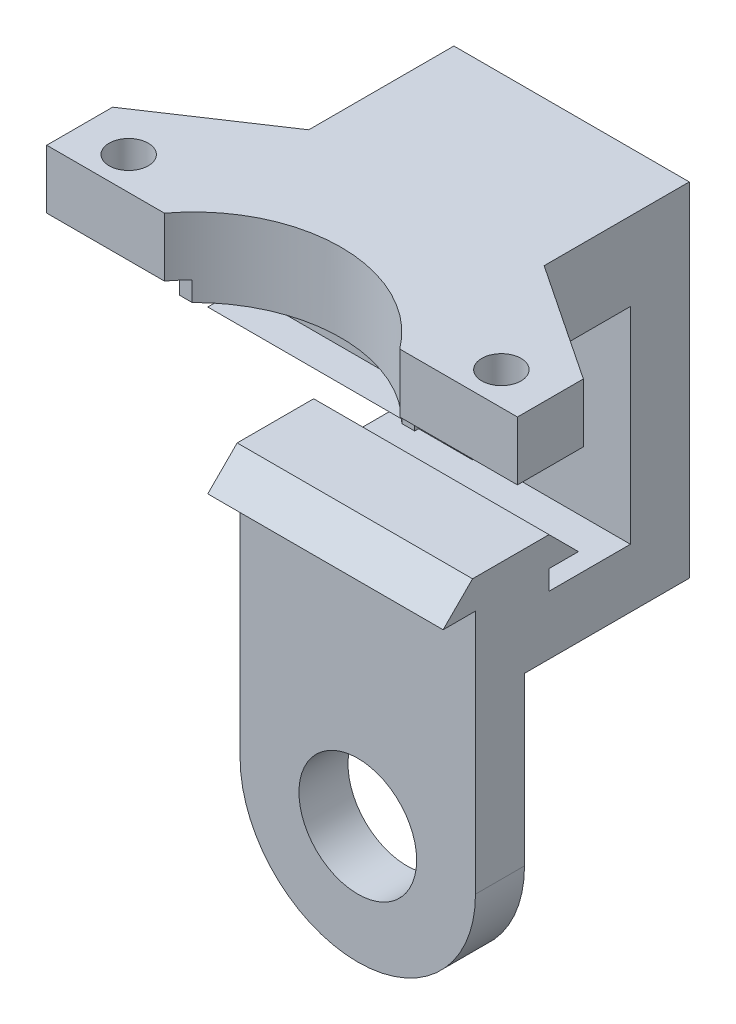
from build123d import *
from build123d.topology import SkipClean

# Parameters (mm, degrees)
ESBO_O1_R                = 6
RESSALTO_EXTRUS_O1_DEPTH = 5
RESSALTO_EXTRUS_O2_DEPTH = 24
ESBO_O3_R                = 2
RESSALTO_EXTRUS_O3_DEPTH = 6
ESBO_O5_R                = 15
CORTE_EXTRUS_O1_DEPTH    = 10


with BuildPart() as part:
    # Esboço1 → Ressalto-extrusão1 (new body)
    with BuildSketch(Plane.XY):
        with BuildLine():
            Line((-12, 0), (-12, 17))
            Line((-12, 17), (12, 17))
            Line((12, 17), (12, 0))
            ThreePointArc((12, 0), (0, -12), (-12, 0))
        make_face()
        Circle(ESBO_O1_R, mode=Mode.SUBTRACT)
    extrude(amount=RESSALTO_EXTRUS_O1_DEPTH)

    # Esboço2 → Ressalto-extrusão2 (add)
    with BuildSketch(Plane.ZY.offset(12)):
        Polygon((5, 17), (0.2, 17), (-10.8, 17), (-16.8, 17), (-16.8, 52), (11.2, 52), (11.2, 44), (5, 44), (5, 41.5), (8.3, 41.5), (5.3, 38.5), (-2.5, 38.5), (-5.5, 41.5), (-2.5, 41.5), (-2.5, 44), (-10.8, 44), (-10.8, 23), (-2.5, 23), (-2.5, 25), (-5.5, 25), (-2.5, 28), (5.3, 28), (8.3, 25), (5, 25), align=None)
    extrude(amount=-RESSALTO_EXTRUS_O2_DEPTH)

    # Esboço3 → Ressalto-extrusão3 (add)
    with BuildSketch(Plane(origin=(0, 52, 0), x_dir=(1, 0, 0), z_dir=(0, 1, 0))):
        with BuildLine():
            Line((12, -6), (-12, -6))
            Line((-12, -6), (-12, 2))
            Line((-12, 2), (-24, -6))
            Line((-24, -6), (-24, -12.72))
            Line((-24, -12.72), (-12, -12.72))
            ThreePointArc((-12, -12.72), (0, -6.72), (12, -12.72))
            Line((12, -12.72), (24, -12.72))
            Line((24, -12.72), (24, -6))
            Line((24, -6), (12, 2))
            Line((12, 2), (12, -6))
        make_face()
        with Locations(Location((19, -9.36, 0), (0, 0, 90))):
            Circle(ESBO_O3_R, mode=Mode.SUBTRACT)
        with Locations(Location((-19, -9.36, 0), (0, 0, 90))):
            Circle(ESBO_O3_R, mode=Mode.SUBTRACT)
    extrude(amount=-RESSALTO_EXTRUS_O3_DEPTH)

    # Esboço5 → Corte-extrusão1 (cut)
    with SkipClean():  # the faces are left unmerged after this step: merging them gives an invalid solid
        with BuildSketch(Plane(origin=(0, 52, 0), x_dir=(1, 0, 0), z_dir=(0, 1, 0))):
            with Locations((0, -21.72)):
                Circle(ESBO_O5_R)
        extrude(amount=-CORTE_EXTRUS_O1_DEPTH, mode=Mode.SUBTRACT)


solid = part.part
